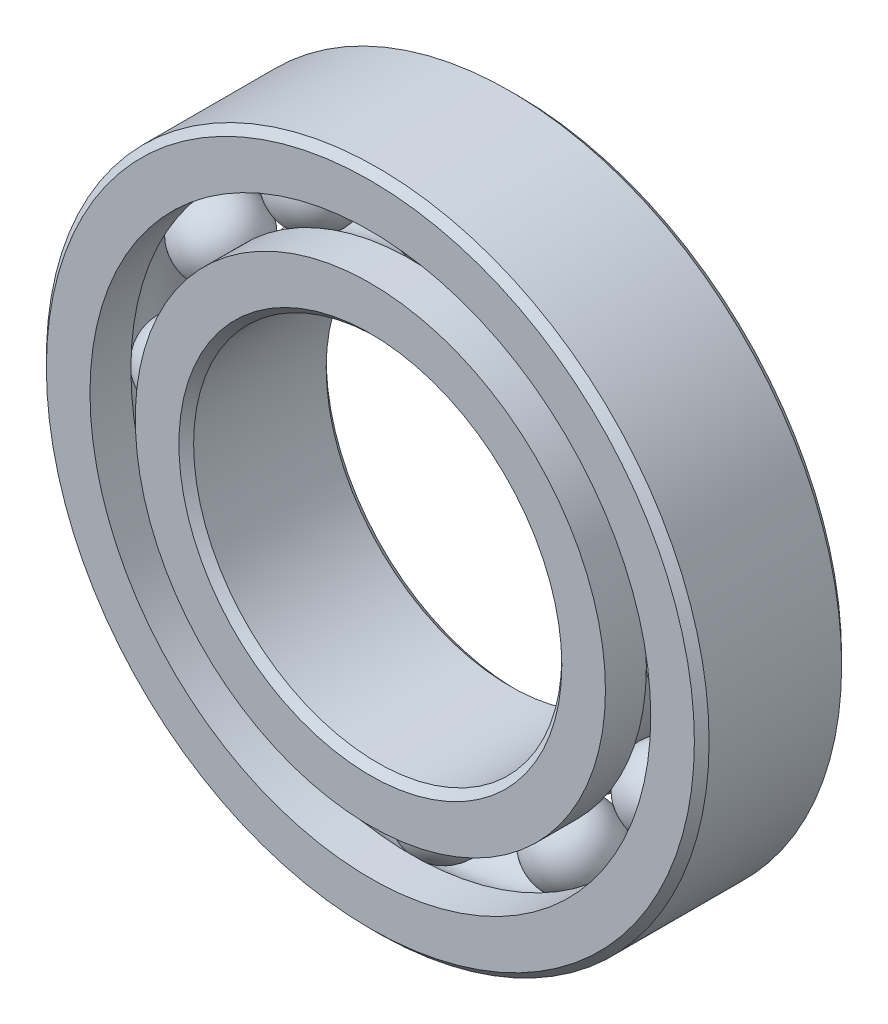
from build123d import *

# Parameters (mm, degrees)
CIRPATTERN1_COUNT = 12


with BuildPart() as part:
    # Sketch1 → Revolve1 (revolve)
    with BuildSketch(Plane(origin=(0, 0, 0), x_dir=(0, 0, -1), z_dir=(1, 0, 0)), mode=Mode.PRIVATE) as revolve1_sk:
        with BuildLine():
            Line((9, 45), (-9, 45))
            Line((-9, 45), (-10, 44))
            Line((-10, 44), (-10, 38.076923077))
            Line((-10, 38.076923077), (-4.444444444, 38.076923077))
            ThreePointArc((-4.444444444, 38.076923077), (0, 40.405602838), (4.444444444, 38.076923077))
            Line((4.444444444, 38.076923077), (10, 38.076923077))
            Line((10, 38.076923077), (10, 44))
            Line((10, 44), (9, 45))
        make_face()
    revolve(revolve1_sk.sketch.rotate(Axis((0, 0, 10), (0, 0, -1)), 90), axis=Axis((0, 0, 10), (0, 0, -1)))


with BuildPart() as body_2:
    # Sketch3 → Revolve3 (revolve)
    with BuildSketch(Plane(origin=(0, 0, 0), x_dir=(0, 0, -1), z_dir=(1, 0, 0)), mode=Mode.PRIVATE) as revolve3_sk:
        with BuildLine():
            Line((-10, 31.923076923), (-4.444444444, 31.923076923))
            ThreePointArc((-4.444444444, 31.923076923), (0, 29.594397162), (4.444444444, 31.923076923))
            Line((4.444444444, 31.923076923), (10, 31.923076923))
            Line((10, 31.923076923), (10, 26))
            Line((10, 26), (9, 25))
            Line((9, 25), (-9, 25))
            Line((-9, 25), (-10, 26))
            Line((-10, 26), (-10, 31.923076923))
        make_face()
    revolve(revolve3_sk.sketch.rotate(Axis((0, 0, 10), (0, 0, -1)), 90), axis=Axis((0, 0, 10), (0, 0, -1)))


with BuildPart() as body_3:
    # Sketch4 → Revolve4 (revolve)
    with BuildSketch(Plane(origin=(0, 0, 0), x_dir=(0, 0, -1), z_dir=(1, 0, 0))):
        with BuildLine():
            Line((-5.405602838, 35), (5.405602838, 35))
            ThreePointArc((5.405602838, 35), (0, 40.405602838), (-5.405602838, 35))
        make_face()
    revolve(axis=Axis((0, 35, 5.405602838), (0, 0, -1)))


with BuildPart() as cirpattern1_1:
    # CirPattern1: pattern copy
    add(body_3.part.rotate(Axis((0, 0, 0), (0, 0, 1)), 1 * 360 / CIRPATTERN1_COUNT))


with BuildPart() as cirpattern1_2:
    # CirPattern1: pattern copy
    add(body_3.part.rotate(Axis((0, 0, 0), (0, 0, 1)), 2 * 360 / CIRPATTERN1_COUNT))


with BuildPart() as cirpattern1_3:
    # CirPattern1: pattern copy
    add(body_3.part.rotate(Axis((0, 0, 0), (0, 0, 1)), 3 * 360 / CIRPATTERN1_COUNT))


with BuildPart() as cirpattern1_4:
    # CirPattern1: pattern copy
    add(body_3.part.rotate(Axis((0, 0, 0), (0, 0, 1)), 4 * 360 / CIRPATTERN1_COUNT))


with BuildPart() as cirpattern1_5:
    # CirPattern1: pattern copy
    add(body_3.part.rotate(Axis((0, 0, 0), (0, 0, 1)), 5 * 360 / CIRPATTERN1_COUNT))


with BuildPart() as cirpattern1_6:
    # CirPattern1: pattern copy
    add(body_3.part.rotate(Axis((0, 0, 0), (0, 0, 1)), 6 * 360 / CIRPATTERN1_COUNT))


with BuildPart() as cirpattern1_7:
    # CirPattern1: pattern copy
    add(body_3.part.rotate(Axis((0, 0, 0), (0, 0, 1)), 7 * 360 / CIRPATTERN1_COUNT))


with BuildPart() as cirpattern1_8:
    # CirPattern1: pattern copy
    add(body_3.part.rotate(Axis((0, 0, 0), (0, 0, 1)), 8 * 360 / CIRPATTERN1_COUNT))


with BuildPart() as cirpattern1_9:
    # CirPattern1: pattern copy
    add(body_3.part.rotate(Axis((0, 0, 0), (0, 0, 1)), 9 * 360 / CIRPATTERN1_COUNT))


with BuildPart() as cirpattern1_10:
    # CirPattern1: pattern copy
    add(body_3.part.rotate(Axis((0, 0, 0), (0, 0, 1)), 10 * 360 / CIRPATTERN1_COUNT))


with BuildPart() as cirpattern1_11:
    # CirPattern1: pattern copy
    add(body_3.part.rotate(Axis((0, 0, 0), (0, 0, 1)), 11 * 360 / CIRPATTERN1_COUNT))


solid = Compound([part.part, body_2.part, body_3.part, cirpattern1_1.part, cirpattern1_2.part, cirpattern1_3.part, cirpattern1_4.part, cirpattern1_5.part, cirpattern1_6.part, cirpattern1_7.part, cirpattern1_8.part, cirpattern1_9.part, cirpattern1_10.part, cirpattern1_11.part])
